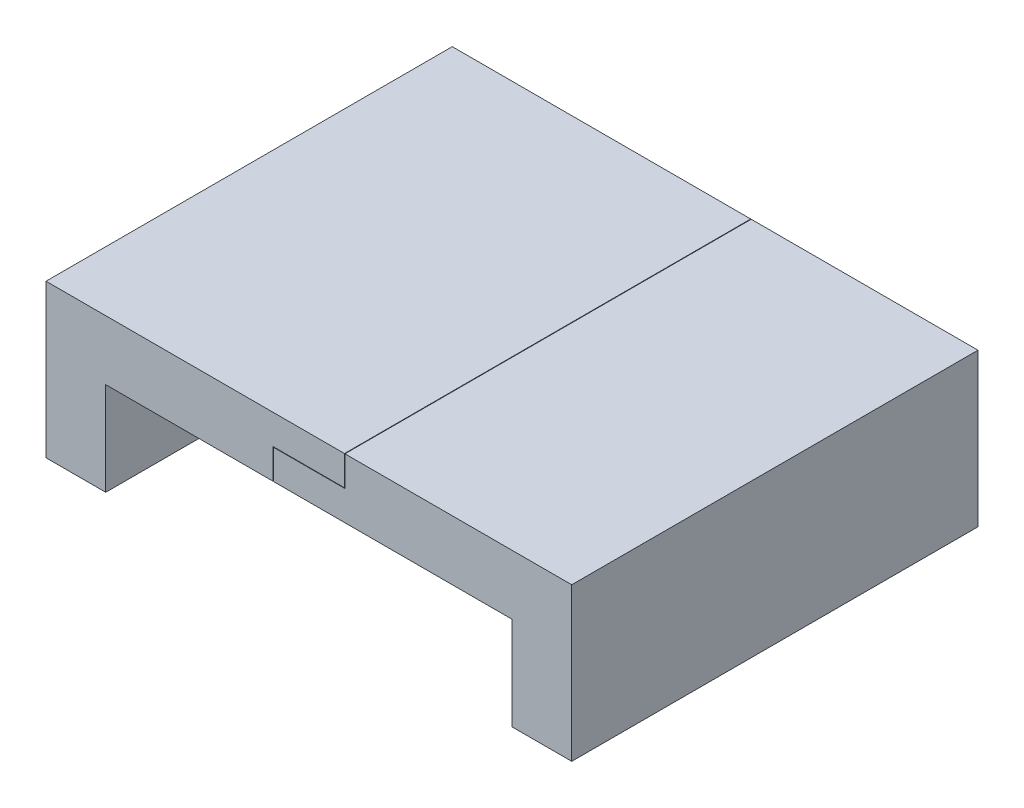
from build123d import *

# Parameters (mm, degrees)
SKETCH1_W                           = 279.4
SKETCH1_H                           = 215.9
BOSS_EXTRUDE1_DEPTH                 = 31.75
SKETCH2_W                           = 31.75
SKETCH2_H                           = 49.53
BOSS_EXTRUDE2_DEPTH                 = 215.9
CUT_EXTRUDE_THIN1_REACH             = 263.882
CUT_EXTRUDE_THIN1_DIRECTION_2_DEPTH = 262.881883489
SKETCH4_R                           = 3
CUT_EXTRUDE1_DEPTH                  = 2
SKETCH5_R                           = 1.7
CUT_EXTRUDE2_DEPTH                  = 22.098
SKETCH6_R                           = 2.032
CUT_EXTRUDE3_DEPTH                  = 6


with BuildPart() as part:
    # Sketch1 → Boss-Extrude1 (new body)
    with BuildSketch(Plane(origin=(0, 0, 0), x_dir=(1, 0, 0), z_dir=(0, 1, 0))):
        Rectangle(SKETCH1_W, SKETCH1_H)
    extrude(amount=BOSS_EXTRUDE1_DEPTH)

    # Sketch2 → Boss-Extrude2 (add)
    with BuildSketch(Plane.XY.offset(107.95)):
        with Locations((-123.825, -24.765)):
            Rectangle(SKETCH2_W, SKETCH2_H)
        with Locations((123.825, -24.765)):
            Rectangle(SKETCH2_W, SKETCH2_H)
    extrude(amount=-BOSS_EXTRUDE2_DEPTH)

    # Sketch3 → Cut-Extrude-Thin1 (cut, up to next)
    with BuildSketch(Plane(origin=(0, 0, -107.95), x_dir=(-1, 0, 0), z_dir=(0, 0, -1)), mode=Mode.PRIVATE) as cut_extrude_thin1_sk1:
        Polygon((-19.177, 31.75), (-19.177, 15.748), (18.923, 15.748), (18.923, 0), (19.177, 0), (19.177, 16.002), (-18.923, 16.002), (-18.923, 31.75), align=None)
    cut_extrude_thin1_tool1 = extrude(cut_extrude_thin1_sk1.sketch, amount=-CUT_EXTRUDE_THIN1_REACH, mode=Mode.PRIVATE) & part.part
    add(cut_extrude_thin1_tool1.solids().sort_by_distance((0, 15.875, -107.95))[0], mode=Mode.SUBTRACT)

    # Sketch3 → Cut-Extrude-Thin1 direction 2 (cut)
    with BuildSketch(Plane(origin=(0, 0, -107.95), x_dir=(-1, 0, 0), z_dir=(0, 0, -1))):
        Polygon((-19.177, 31.75), (-19.177, 15.748), (18.923, 15.748), (18.923, 0), (19.177, 0), (19.177, 16.002), (-18.923, 16.002), (-18.923, 31.75), align=None)
    extrude(amount=CUT_EXTRUDE_THIN1_DIRECTION_2_DEPTH, mode=Mode.SUBTRACT)


with BuildPart() as cut_extrude_thin1_piece_1:
    # of the separate pieces the step leaves, piece 1, a body of its own (cut_extrude_thin1_pieces)
    add(part.part.solids().sort_by_distance((19.177, 31.75, -107.95))[0])

    # Sketch4 → Cut-Extrude1 (cut)
    with BuildSketch(Plane.XZ):
        with Locations(Location((0, 0, 0), (0, 0, 270))):
            Circle(SKETCH4_R)
        with Locations(Location((0.104588235, 88.9, 0), (0, 0, 270))):
            Circle(SKETCH4_R)
        with Locations(Location((0.104588235, -88.9, 0), (0, 0, 270))):
            Circle(SKETCH4_R)
    extrude(amount=-CUT_EXTRUDE1_DEPTH, mode=Mode.SUBTRACT)


with BuildPart() as cut_extrude_thin1_piece_2:
    # of the separate pieces the step leaves, piece 2, a body of its own (cut_extrude_thin1_pieces)
    add(part.part.solids().sort_by_distance((-139.7, -49.53, -107.95))[0])


with BuildPart() as cut_extrude2_tool:
    # Sketch5 → Cut-Extrude2 (new body)
    with BuildSketch(Plane(origin=(0, 2, 0), x_dir=(-1, 0, 0), z_dir=(0, -1, 0))):
        with Locations(Location((-0.104588235, -88.9, 0), (0, 0, 90))):
            Circle(SKETCH5_R)
        with Locations(Location((0, 0, 0), (0, 0, 90))):
            Circle(SKETCH5_R)
        with Locations(Location((-0.104588235, 88.9, 0), (0, 0, 90))):
            Circle(SKETCH5_R)
    extrude(amount=-CUT_EXTRUDE2_DEPTH)


with BuildPart() as cut_extrude_thin1_piece_1_1:
    add(cut_extrude_thin1_piece_1.part)

    # Cut-Extrude2: cut by cut_extrude2_tool
    add(cut_extrude2_tool.part, mode=Mode.SUBTRACT)


with BuildPart() as cut_extrude_thin1_piece_2_1:
    add(cut_extrude_thin1_piece_2.part)

    # Cut-Extrude2: cut by cut_extrude2_tool
    add(cut_extrude2_tool.part, mode=Mode.SUBTRACT)

    # Sketch6 → Cut-Extrude3 (cut)
    with BuildSketch(Plane.XZ.offset(-16.002)):
        with Locations((0.104588235, 88.9)):
            Circle(SKETCH6_R)
        Circle(SKETCH6_R)
        with Locations((0.104588235, -88.9)):
            Circle(SKETCH6_R)
    extrude(amount=-CUT_EXTRUDE3_DEPTH, mode=Mode.SUBTRACT)


solid = Compound([cut_extrude_thin1_piece_1_1.part, cut_extrude_thin1_piece_2_1.part])
